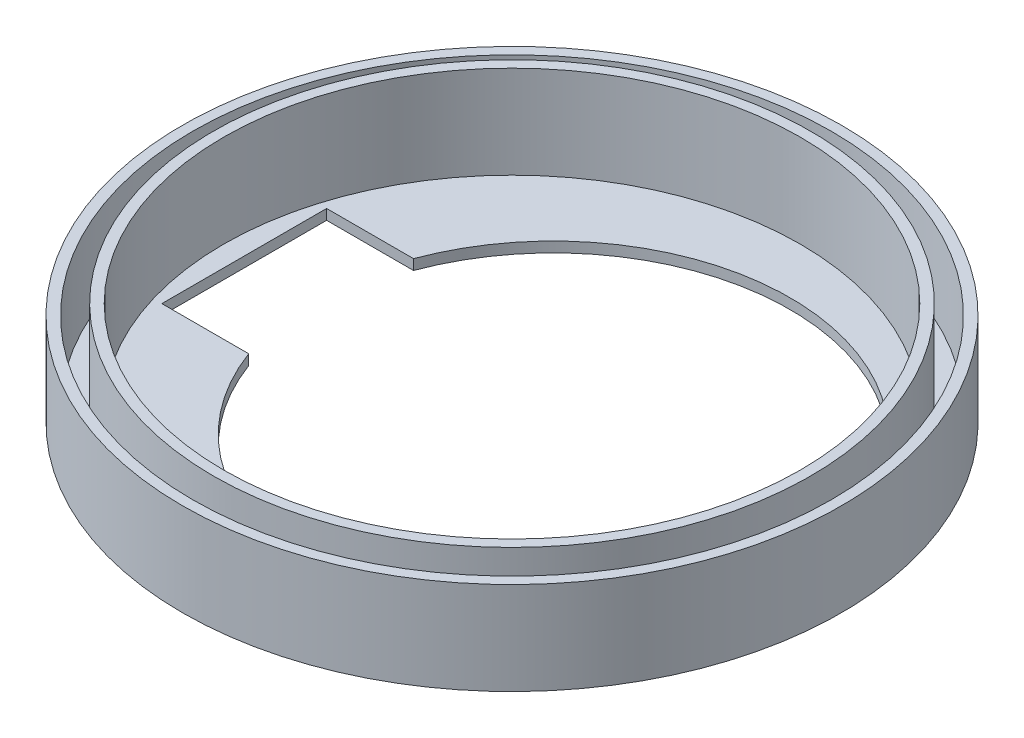
from build123d import *

# Parameters (mm, degrees)
SKETCH1_R           = 16
BOSS_EXTRUDE1_DEPTH = 0.5
SKETCH2_R           = 11.5
CUT_EXTRUDE1_DEPTH  = 0.5
SKETCH3_W           = 15
SKETCH3_H           = 8
CUT_EXTRUDE4_DEPTH  = 2.5
SKETCH4_R           = 16
SKETCH4_R_2         = 15.5
BOSS_EXTRUDE2_DEPTH = 4.5
SKETCH5_R           = 14.5
SKETCH5_R_2         = 14
BOSS_EXTRUDE3_DEPTH = 4.5


with BuildPart() as part:
    # Sketch1 → Boss-Extrude1 (new body)
    with BuildSketch(Plane(origin=(0, 0, 0), x_dir=(1, 0, 0), z_dir=(0, 1, 0))):
        with Locations(Location((0, 0, 0), (0, 0, 270))):
            Circle(SKETCH1_R)
    extrude(amount=BOSS_EXTRUDE1_DEPTH)

    # Sketch2 → Cut-Extrude1 (cut)
    with BuildSketch(Plane(origin=(0, 0.5, 0), x_dir=(1, 0, 0), z_dir=(0, 1, 0))):
        with Locations(Location((2, 0, 0), (0, 0, 270))):
            Circle(SKETCH2_R)
    extrude(amount=-CUT_EXTRUDE1_DEPTH, mode=Mode.SUBTRACT)

    # Sketch3 → Cut-Extrude4 (cut)
    with BuildSketch(Plane(origin=(0, 0, 0), x_dir=(1, 0, 0), z_dir=(0, 1, 0))):
        with Locations((-5.5, 0)):
            Rectangle(SKETCH3_W, SKETCH3_H)
    extrude(amount=CUT_EXTRUDE4_DEPTH, mode=Mode.SUBTRACT)

    # Sketch4 → Boss-Extrude2 (add)
    with BuildSketch(Plane(origin=(0, 0, 0), x_dir=(1, 0, 0), z_dir=(0, 1, 0))):
        with Locations(Location((0, 0, 0), (0, 0, 270))):
            Circle(SKETCH4_R)
        with Locations(Location((0, 0, 0), (0, 0, 270))):
            Circle(SKETCH4_R_2, mode=Mode.SUBTRACT)
    extrude(amount=BOSS_EXTRUDE2_DEPTH)

    # Sketch5 → Boss-Extrude3 (add)
    with BuildSketch(Plane(origin=(0, 0.5, 0), x_dir=(1, 0, 0), z_dir=(0, 1, 0))):
        with Locations(Location((0, 0, 0), (0, 0, 270))):
            Circle(SKETCH5_R)
        with Locations(Location((0, 0, 0), (0, 0, 270))):
            Circle(SKETCH5_R_2, mode=Mode.SUBTRACT)
    extrude(amount=BOSS_EXTRUDE3_DEPTH)


solid = part.part
